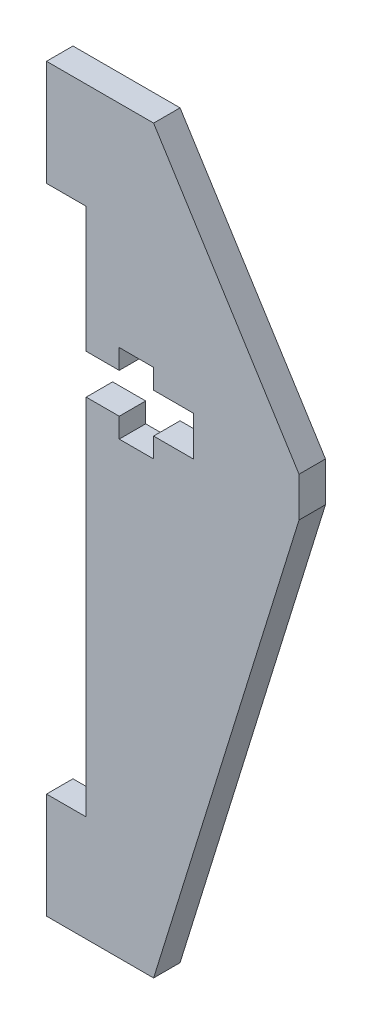
from build123d import *

# Parameters (mm, degrees)
EXTRUDE_1_DEPTH = 2


with BuildPart() as part:
    # 草图1 → 凸台-拉伸1 (new body)
    with BuildSketch(Plane.XY):
        Polygon((2.5, -1.5), (2.5, -3), (5.1, -3), (5.1, -1.5), (8.1, -1.5), (8.1, 1.5), (5.1, 1.5), (5.1, 3), (2.5, 3), (2.5, 1.5), (0, 1.5), (0, 11), (-3, 11), (-3, 19), (0, 19), (5.1, 19), (16.1, 1.5), (16.1, -1.5), (5.1, -37), (0, -37), (-3, -37), (-3, -29), (0, -29), (0, -1.5), align=None)
    extrude(amount=EXTRUDE_1_DEPTH)


solid = part.part
